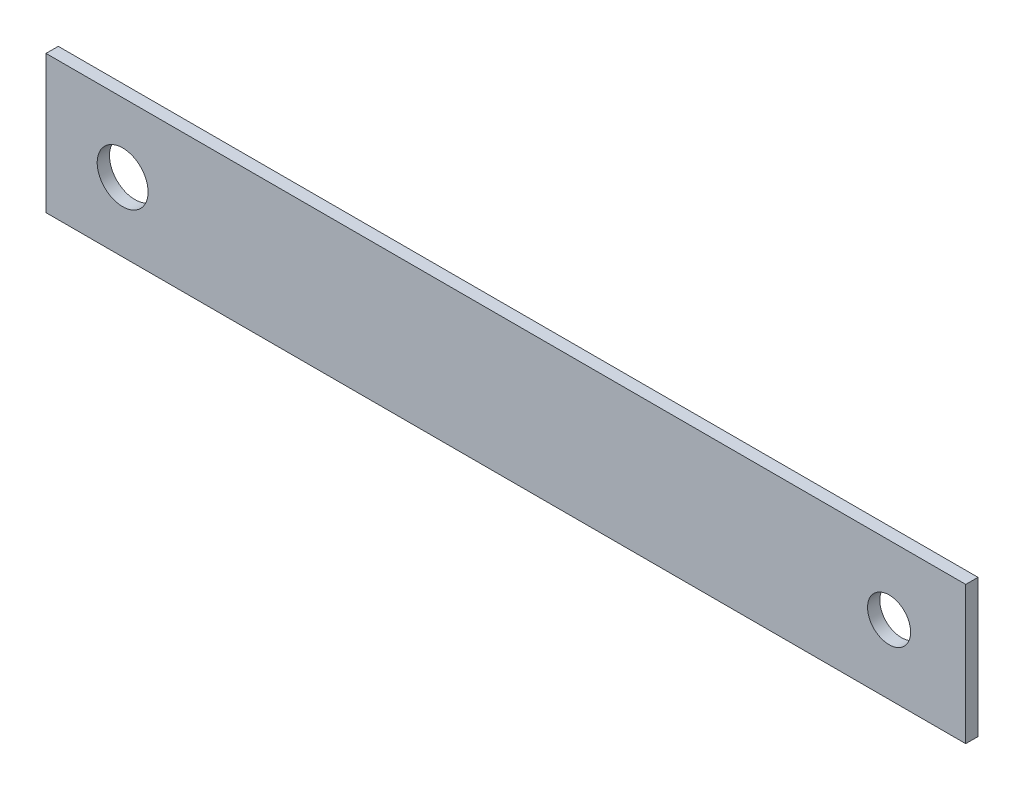
from build123d import *

# Parameters (mm, degrees)
SKETCH1_W           = 76.2
SKETCH1_H           = 11.43
SKETCH1_R           = 2.1082
SKETCH1_R_2         = 1.78562
BOSS_EXTRUDE1_DEPTH = 1.016


with BuildPart() as part:
    # Sketch1 → Boss-Extrude1 (new body)
    with BuildSketch(Plane.XY):
        with Locations((31.75, 0)):
            Rectangle(SKETCH1_W, SKETCH1_H)
        Circle(SKETCH1_R, mode=Mode.SUBTRACT)
        with Locations((63.5, 0)):
            Circle(SKETCH1_R_2, mode=Mode.SUBTRACT)
    extrude(amount=BOSS_EXTRUDE1_DEPTH)


solid = part.part
